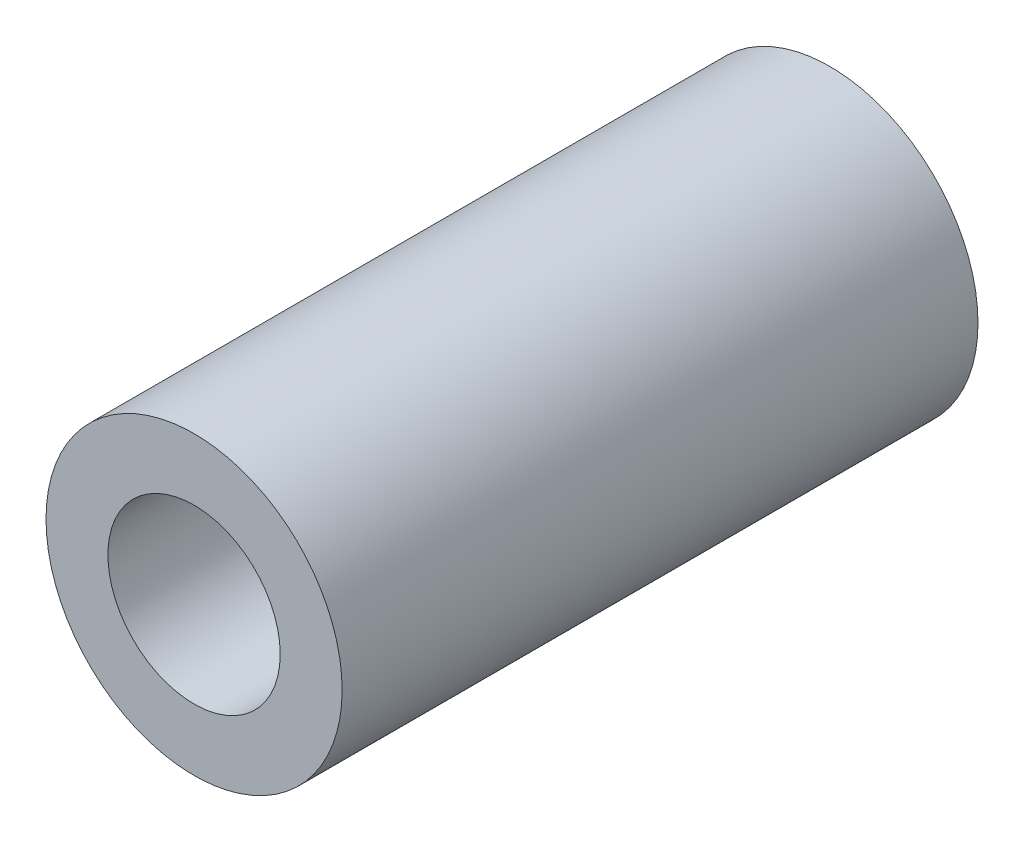
from build123d import *

# Parameters (mm, degrees)
SKETCH_1_R      = 2.75
SKETCH_1_R_2    = 1.6
EXTRUDE_1_DEPTH = 11.81


with BuildPart() as part:
    # 草圖1 → 填料-伸長1 (new body)
    with BuildSketch(Plane.XY):
        Circle(SKETCH_1_R)
        Circle(SKETCH_1_R_2, mode=Mode.SUBTRACT)
    extrude(amount=EXTRUDE_1_DEPTH)


solid = part.part
